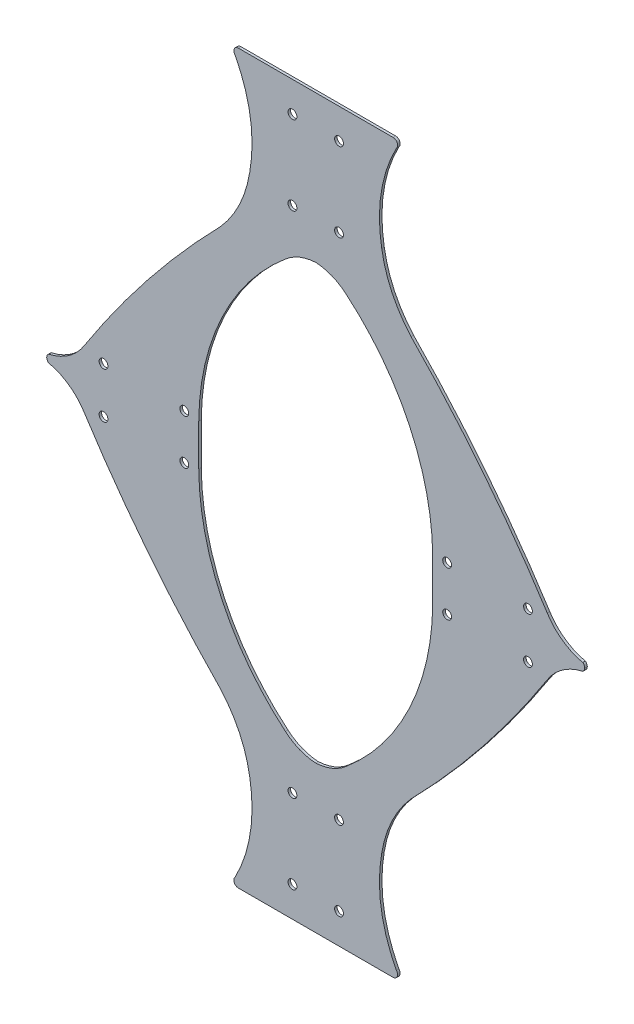
from build123d import *

# Parameters (mm, degrees)
SKETCH2_R           = 11.1125
BOSS_EXTRUDE1_DEPTH = 6.35


with BuildPart() as part:
    # Sketch2 → Boss-Extrude1 (new body)
    with BuildSketch(Plane.XY):
        with BuildLine():
            Line((0, 914.4), (-194.479849892, 914.4))
            ThreePointArc((-194.479849892, 914.4), (-204.91887294, 907.625287079), (-202.983200568, 895.332073104))
            ThreePointArc((-202.983200568, 895.332073104), (-164.535916973, 779.903104595), (-165.892020397, 658.247026365))
            Line((-165.892020397, 658.247026365), (-165.938886188, 658.129795086))
            ThreePointArc((-165.938886188, 658.129795086), (-174.522720833, 620.054602536), (-187.919807247, 583.395080165))
            ThreePointArc((-187.919807247, 583.395080165), (-210.62430537, 541.201744159), (-239.683438479, 503.105305725))
            ThreePointArc((-239.683438479, 503.105305725), (-421.799875663, 296.628923536), (-582.037423098, 72.747657042))
            ThreePointArc((-582.037423098, 72.747657042), (-620.339092238, 32.211350912), (-671.307126152, 9.573561873))
            ThreePointArc((-671.307126152, 9.573561873), (-674.990888604, 5.409489794), (-676.274252252, 0))
            ThreePointArc((-676.274252252, 0), (-674.990888604, -5.409489794), (-671.307126152, -9.573561873))
            ThreePointArc((-671.307126152, -9.573561873), (-620.339092238, -32.211350912), (-582.037423098, -72.747657042))
            ThreePointArc((-582.037423098, -72.747657042), (-421.799875663, -296.628923536), (-239.683438479, -503.105305725))
            ThreePointArc((-239.683438479, -503.105305725), (-191.627212465, -575.297388544), (-165.938886188, -658.129795086))
            Line((-165.938886188, -658.129795086), (-165.892020397, -658.247026365))
            ThreePointArc((-165.892020397, -658.247026365), (-164.535916973, -779.903104595), (-202.983200568, -895.332073104))
            ThreePointArc((-202.983200568, -895.332073104), (-204.91887294, -907.625287079), (-194.479849892, -914.4))
            Line((-194.479849892, -914.4), (0, -914.4))
            Line((0, -914.4), (194.479849892, -914.4))
            ThreePointArc((194.479849892, -914.4), (204.91887294, -907.625287079), (202.983200568, -895.332073104))
            ThreePointArc((202.983200568, -895.332073104), (164.535916973, -779.903104595), (165.892020397, -658.247026365))
            Line((165.892020397, -658.247026365), (165.938886188, -658.129795086))
            ThreePointArc((165.938886188, -658.129795086), (174.522720833, -620.054602536), (187.919807247, -583.395080165))
            ThreePointArc((187.919807247, -583.395080165), (210.62430537, -541.201744159), (239.683438479, -503.105305725))
            ThreePointArc((239.683438479, -503.105305725), (421.799875663, -296.628923536), (582.037423098, -72.747657043))
            ThreePointArc((582.037423098, -72.747657043), (620.339092238, -32.211350912), (671.307126152, -9.573561873))
            ThreePointArc((671.307126152, -9.573561873), (674.990888603, -5.409489794), (676.274252252, 0))
            ThreePointArc((676.274252252, 0), (674.990888604, 5.409489794), (671.307126152, 9.573561873))
            ThreePointArc((671.307126152, 9.573561873), (620.339092238, 32.211350912), (582.037423098, 72.747657042))
            ThreePointArc((582.037423098, 72.747657042), (421.799875663, 296.628923536), (239.683438479, 503.105305725))
            ThreePointArc((239.683438479, 503.105305725), (191.627212465, 575.297388544), (165.938886188, 658.129795086))
            Line((165.938886188, 658.129795086), (165.892020397, 658.247026365))
            ThreePointArc((165.892020397, 658.247026365), (164.535916973, 779.903104595), (202.983200568, 895.332073104))
            ThreePointArc((202.983200568, 895.332073104), (204.91887294, 907.625287079), (194.479849892, 914.4))
            Line((194.479849892, 914.4), (0, 914.4))
        make_face()
        with Locations((-58.541769794, -639.405335996)):
            Circle(SKETCH2_R, mode=Mode.SUBTRACT)
        with Locations((-58.541769794, -838.268909678)):
            Circle(SKETCH2_R, mode=Mode.SUBTRACT)
        with Locations((58.541769794, -838.268909678)):
            Circle(SKETCH2_R, mode=Mode.SUBTRACT)
        with Locations((58.541769794, -639.405335996)):
            Circle(SKETCH2_R, mode=Mode.SUBTRACT)
        with Locations((533.590599666, -57.767812484)):
            Circle(SKETCH2_R, mode=Mode.SUBTRACT)
        with Locations((330.356144827, -56.532187516)):
            Circle(SKETCH2_R, mode=Mode.SUBTRACT)
        with Locations((330.356144827, 56.532187516)):
            Circle(SKETCH2_R, mode=Mode.SUBTRACT)
        with Locations((533.590599666, 57.767812484)):
            Circle(SKETCH2_R, mode=Mode.SUBTRACT)
        with Locations((58.541769794, 838.268909678)):
            Circle(SKETCH2_R, mode=Mode.SUBTRACT)
        with Locations((-58.541769794, 838.268909678)):
            Circle(SKETCH2_R, mode=Mode.SUBTRACT)
        with Locations((-58.541769794, 639.405335996)):
            Circle(SKETCH2_R, mode=Mode.SUBTRACT)
        with Locations((58.541769794, 639.405335996)):
            Circle(SKETCH2_R, mode=Mode.SUBTRACT)
        with Locations((-330.356144827, -56.532187516)):
            Circle(SKETCH2_R, mode=Mode.SUBTRACT)
        with Locations((-330.356144827, 56.532187516)):
            Circle(SKETCH2_R, mode=Mode.SUBTRACT)
        with Locations((-533.590599666, 57.767812484)):
            Circle(SKETCH2_R, mode=Mode.SUBTRACT)
        with Locations((-533.590599666, -57.767812484)):
            Circle(SKETCH2_R, mode=Mode.SUBTRACT)
        with BuildLine():
            Line((294.116579618, 52.07611641), (294.116579618, -52.07611641))
            ThreePointArc((294.116579618, -52.07611641), (242.916605185, -291.544447454), (101.6983636, -491.604256507))
            ThreePointArc((101.6983636, -491.604256507), (89.07407881, -503.133976698), (76.131755899, -514.305516063))
            ThreePointArc((76.131755899, -514.305516063), (40.620898237, -536.014461284), (0, -545.083195538))
            ThreePointArc((0, -545.083195538), (-40.620898237, -536.014461284), (-76.131755899, -514.305516063))
            ThreePointArc((-76.131755899, -514.305516063), (-235.841357727, -307.108762007), (-294.116579618, -52.07611641))
            Line((-294.116579618, -52.07611641), (-294.116579618, 52.07611641))
            ThreePointArc((-294.116579618, 52.07611641), (-242.916605185, 291.544447454), (-101.6983636, 491.604256507))
            ThreePointArc((-101.6983636, 491.604256507), (-89.07407881, 503.133976698), (-76.131755899, 514.305516063))
            ThreePointArc((-76.131755899, 514.305516063), (-40.620898237, 536.014461284), (0, 545.083195538))
            ThreePointArc((0, 545.083195538), (40.620898237, 536.014461284), (76.131755899, 514.305516063))
            ThreePointArc((76.131755899, 514.305516063), (235.841357727, 307.108762007), (294.116579618, 52.07611641))
        make_face(mode=Mode.SUBTRACT)
    extrude(amount=BOSS_EXTRUDE1_DEPTH)


solid = part.part
